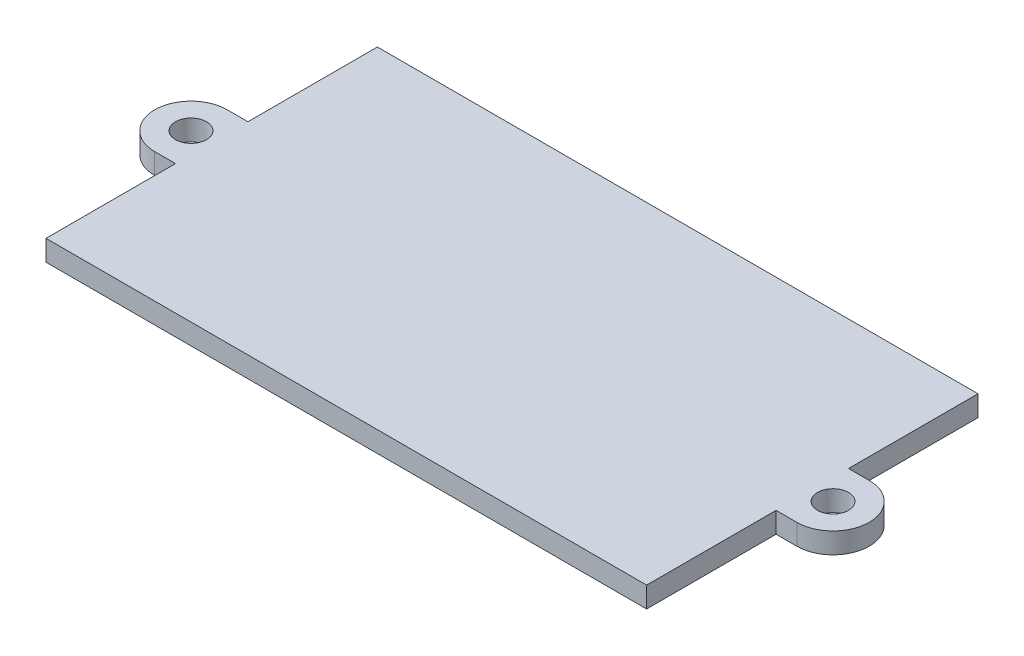
from build123d import *

# Parameters (mm, degrees)
CROQUIS1_R              = 1.5
SALIENTE_EXTRUIR1_DEPTH = 2


with BuildPart() as part:
    # Croquis1 → Saliente-Extruir1 (new body)
    # profile 1 of 3: a face of its own
    with BuildSketch(Plane(origin=(0, 0, 0), x_dir=(1, 0, 0), z_dir=(0, 1, 0))):
        Polygon((-29, -16), (-29, 0), (-29, 16), (0, 16), (29, 16), (29, 0), (29, -16), (0, -16), align=None)
    # profile 2 of 3: a face of its own
    with BuildSketch(Plane(origin=(0, 0, 0), x_dir=(1, 0, 0), z_dir=(0, 1, 0))):
        with BuildLine():
            Line((31, 3.5), (29, 3.5))
            Line((29, 3.5), (29, 0))
            Line((29, 0), (29, -3.5))
            Line((29, -3.5), (31, -3.5))
            ThreePointArc((31, -3.5), (34.5, 0), (31, 3.5))
        make_face()
        with Locations(Location((31, 0, 0), (0, 0, 270))):
            Circle(CROQUIS1_R, mode=Mode.SUBTRACT)
    # profile 3 of 3: a face of its own
    with BuildSketch(Plane(origin=(0, 0, 0), x_dir=(1, 0, 0), z_dir=(0, 1, 0))):
        with BuildLine():
            Line((-29, -3.5), (-29, 0))
            Line((-29, 0), (-29, 3.5))
            Line((-29, 3.5), (-31, 3.5))
            ThreePointArc((-31, 3.5), (-34.5, 0), (-31, -3.5))
            Line((-31, -3.5), (-29, -3.5))
        make_face()
        with Locations(Location((-31, 0, 0), (0, 0, 270))):
            Circle(CROQUIS1_R, mode=Mode.SUBTRACT)
    extrude(amount=SALIENTE_EXTRUIR1_DEPTH)


solid = part.part
